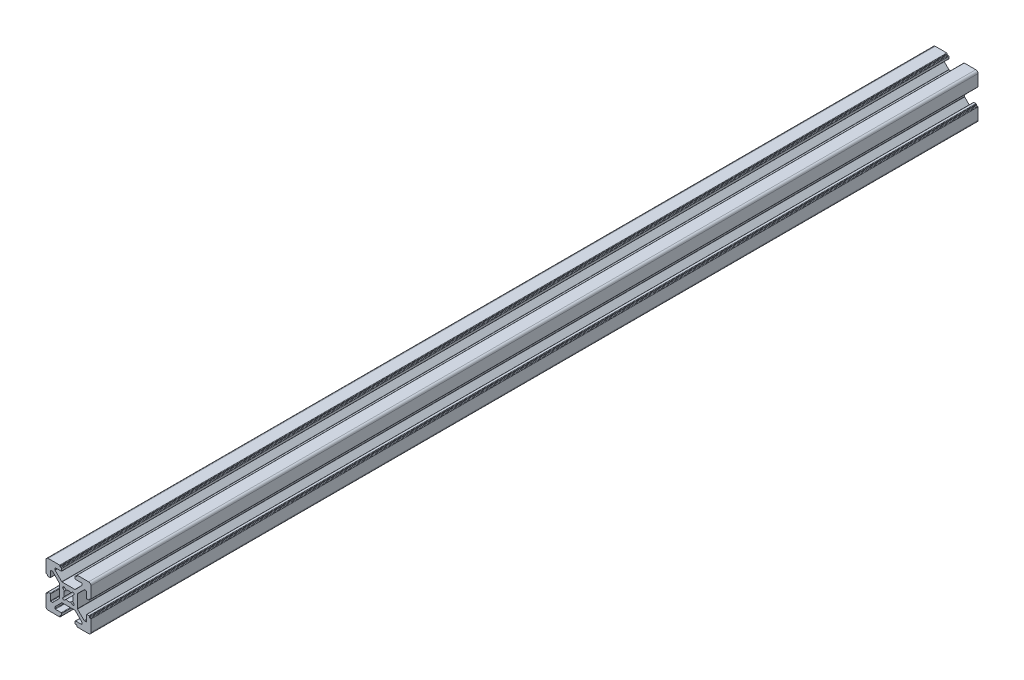
from build123d import *

# Parameters (mm, degrees)
RESSALTO_EXTRUS_O1_DEPTH = 197.5


with BuildPart() as part:
    # Model → Ressalto-extrusão1 (new, symmetric)
    with BuildSketch(Plane.XY):
        with BuildLine():
            Line((-10, 9), (-10, 3.9))
            ThreePointArc((-10, 3.9), (-9.941421356, 3.758578644), (-9.8, 3.7))
            Line((-9.8, 3.7), (-9.5, 3.7))
            ThreePointArc((-9.5, 3.7), (-9.358578644, 3.641421356), (-9.3, 3.5))
            Line((-9.3, 3.5), (-9.3, 3.2))
            ThreePointArc((-9.3, 3.2), (-9.241421356, 3.058578644), (-9.1, 3))
            Line((-9.1, 3), (-8.2, 3))
            ThreePointArc((-8.2, 3), (-8.058578644, 3.058578644), (-8, 3.2))
            Line((-8, 3.2), (-8, 5.8))
            ThreePointArc((-8, 5.8), (-7.941421356, 5.941421356), (-7.8, 6))
            Line((-7.8, 6), (-7.143502884, 6))
            ThreePointArc((-7.143502884, 6), (-7.066966198, 5.984775907), (-7.002081528, 5.941421356))
            Line((-7.002081528, 5.941421356), (-4.058578644, 2.997918472))
            ThreePointArc((-4.058578644, 2.997918472), (-4.015224093, 2.933033802), (-4, 2.856497116))
            Line((-4, 2.856497116), (-4, -2.856497116))
            ThreePointArc((-4, -2.856497116), (-4.015224093, -2.933033802), (-4.058578644, -2.997918472))
            Line((-4.058578644, -2.997918472), (-7.002081528, -5.941421356))
            ThreePointArc((-7.002081528, -5.941421356), (-7.066966198, -5.984775907), (-7.143502884, -6))
            Line((-7.143502884, -6), (-7.8, -6))
            ThreePointArc((-7.8, -6), (-7.941421356, -5.941421356), (-8, -5.8))
            Line((-8, -5.8), (-8, -3.2))
            ThreePointArc((-8, -3.2), (-8.058578644, -3.058578644), (-8.2, -3))
            Line((-8.2, -3), (-9.1, -3))
            ThreePointArc((-9.1, -3), (-9.241421356, -3.058578644), (-9.3, -3.2))
            Line((-9.3, -3.2), (-9.3, -3.5))
            ThreePointArc((-9.3, -3.5), (-9.358578644, -3.641421356), (-9.5, -3.7))
            Line((-9.5, -3.7), (-9.8, -3.7))
            ThreePointArc((-9.8, -3.7), (-9.941421356, -3.758578644), (-10, -3.9))
            Line((-10, -3.9), (-10, -9))
            ThreePointArc((-10, -9), (-9.707106781, -9.707106781), (-9, -10))
            Line((-9, -10), (-3.9, -10))
            ThreePointArc((-3.9, -10), (-3.758578644, -9.941421356), (-3.7, -9.8))
            Line((-3.7, -9.8), (-3.7, -9.5))
            ThreePointArc((-3.7, -9.5), (-3.641421356, -9.358578644), (-3.5, -9.3))
            Line((-3.5, -9.3), (-3.2, -9.3))
            ThreePointArc((-3.2, -9.3), (-3.058578644, -9.241421356), (-3, -9.1))
            Line((-3, -9.1), (-3, -8.2))
            ThreePointArc((-3, -8.2), (-3.058578644, -8.058578644), (-3.2, -8))
            Line((-3.2, -8), (-5.8, -8))
            ThreePointArc((-5.8, -8), (-5.941421356, -7.941421356), (-6, -7.8))
            Line((-6, -7.8), (-6, -7.143502884))
            ThreePointArc((-6, -7.143502884), (-5.984775907, -7.066966198), (-5.941421356, -7.002081528))
            Line((-5.941421356, -7.002081528), (-2.997918472, -4.058578644))
            ThreePointArc((-2.997918472, -4.058578644), (-2.933033802, -4.015224093), (-2.856497116, -4))
            Line((-2.856497116, -4), (2.856497116, -4))
            ThreePointArc((2.856497116, -4), (2.933033802, -4.015224093), (2.997918472, -4.058578644))
            Line((2.997918472, -4.058578644), (5.941421356, -7.002081528))
            ThreePointArc((5.941421356, -7.002081528), (5.984775907, -7.066966198), (6, -7.143502884))
            Line((6, -7.143502884), (6, -7.8))
            ThreePointArc((6, -7.8), (5.941421356, -7.941421356), (5.8, -8))
            Line((5.8, -8), (3.2, -8))
            ThreePointArc((3.2, -8), (3.058578644, -8.058578644), (3, -8.2))
            Line((3, -8.2), (3, -9.1))
            ThreePointArc((3, -9.1), (3.058578644, -9.241421356), (3.2, -9.3))
            Line((3.2, -9.3), (3.5, -9.3))
            ThreePointArc((3.5, -9.3), (3.641421356, -9.358578644), (3.7, -9.5))
            Line((3.7, -9.5), (3.7, -9.8))
            ThreePointArc((3.7, -9.8), (3.758578644, -9.941421356), (3.9, -10))
            Line((3.9, -10), (9, -10))
            ThreePointArc((9, -10), (9.707106781, -9.707106781), (10, -9))
            Line((10, -9), (10, -3.9))
            ThreePointArc((10, -3.9), (9.941421356, -3.758578644), (9.8, -3.7))
            Line((9.8, -3.7), (9.5, -3.7))
            ThreePointArc((9.5, -3.7), (9.358578644, -3.641421356), (9.3, -3.5))
            Line((9.3, -3.5), (9.3, -3.2))
            ThreePointArc((9.3, -3.2), (9.241421356, -3.058578644), (9.1, -3))
            Line((9.1, -3), (8.2, -3))
            ThreePointArc((8.2, -3), (8.058578644, -3.058578644), (8, -3.2))
            Line((8, -3.2), (8, -5.8))
            ThreePointArc((8, -5.8), (7.941421356, -5.941421356), (7.8, -6))
            Line((7.8, -6), (7.143502884, -6))
            ThreePointArc((7.143502884, -6), (7.066966198, -5.984775907), (7.002081528, -5.941421356))
            Line((7.002081528, -5.941421356), (4.058578644, -2.997918472))
            ThreePointArc((4.058578644, -2.997918472), (4.015224093, -2.933033802), (4, -2.856497116))
            Line((4, -2.856497116), (4, 2.856497116))
            ThreePointArc((4, 2.856497116), (4.015224093, 2.933033802), (4.058578644, 2.997918472))
            Line((4.058578644, 2.997918472), (7.002081528, 5.941421356))
            ThreePointArc((7.002081528, 5.941421356), (7.066966198, 5.984775907), (7.143502884, 6))
            Line((7.143502884, 6), (7.8, 6))
            ThreePointArc((7.8, 6), (7.941421356, 5.941421356), (8, 5.8))
            Line((8, 5.8), (8, 3.2))
            ThreePointArc((8, 3.2), (8.058578644, 3.058578644), (8.2, 3))
            Line((8.2, 3), (9.1, 3))
            ThreePointArc((9.1, 3), (9.241421356, 3.058578644), (9.3, 3.2))
            Line((9.3, 3.2), (9.3, 3.5))
            ThreePointArc((9.3, 3.5), (9.358578644, 3.641421356), (9.5, 3.7))
            Line((9.5, 3.7), (9.8, 3.7))
            ThreePointArc((9.8, 3.7), (9.941421356, 3.758578644), (10, 3.9))
            Line((10, 3.9), (10, 9))
            ThreePointArc((10, 9), (9.707106781, 9.707106781), (9, 10))
            Line((9, 10), (3.9, 10))
            ThreePointArc((3.9, 10), (3.758578644, 9.941421356), (3.7, 9.8))
            Line((3.7, 9.8), (3.7, 9.5))
            ThreePointArc((3.7, 9.5), (3.641421356, 9.358578644), (3.5, 9.3))
            Line((3.5, 9.3), (3.2, 9.3))
            ThreePointArc((3.2, 9.3), (3.058578644, 9.241421356), (3, 9.1))
            Line((3, 9.1), (3, 8.2))
            ThreePointArc((3, 8.2), (3.058578644, 8.058578644), (3.2, 8))
            Line((3.2, 8), (5.8, 8))
            ThreePointArc((5.8, 8), (5.941421356, 7.941421356), (6, 7.8))
            Line((6, 7.8), (6, 7.143502884))
            ThreePointArc((6, 7.143502884), (5.984775907, 7.066966198), (5.941421356, 7.002081528))
            Line((5.941421356, 7.002081528), (2.997918472, 4.058578644))
            ThreePointArc((2.997918472, 4.058578644), (2.933033802, 4.015224093), (2.856497116, 4))
            Line((2.856497116, 4), (-2.856497116, 4))
            ThreePointArc((-2.856497116, 4), (-2.933033802, 4.015224093), (-2.997918472, 4.058578644))
            Line((-2.997918472, 4.058578644), (-5.941421356, 7.002081528))
            ThreePointArc((-5.941421356, 7.002081528), (-5.984775907, 7.066966198), (-6, 7.143502884))
            Line((-6, 7.143502884), (-6, 7.8))
            ThreePointArc((-6, 7.8), (-5.941421356, 7.941421356), (-5.8, 8))
            Line((-5.8, 8), (-3.2, 8))
            ThreePointArc((-3.2, 8), (-3.058578644, 8.058578644), (-3, 8.2))
            Line((-3, 8.2), (-3, 9.1))
            ThreePointArc((-3, 9.1), (-3.058578644, 9.241421356), (-3.2, 9.3))
            Line((-3.2, 9.3), (-3.5, 9.3))
            ThreePointArc((-3.5, 9.3), (-3.641421356, 9.358578644), (-3.7, 9.5))
            Line((-3.7, 9.5), (-3.7, 9.8))
            ThreePointArc((-3.7, 9.8), (-3.758578644, 9.941421356), (-3.9, 10))
            Line((-3.9, 10), (-9, 10))
            ThreePointArc((-9, 10), (-9.707106781, 9.707106781), (-10, 9))
        make_face()
        with BuildLine():
            Line((-2.4, -1.667949192), (-1.805131169, -1.073080362))
            ThreePointArc((-1.805131169, -1.073080362), (-2.02494151, -0.556427787), (-2.1, 7.27e-07))
            ThreePointArc((-2.1, 7.27e-07), (-2.024941317, 0.556428488), (-1.805131169, 1.073080362))
            Line((-1.805131169, 1.073080362), (-2.4, 1.667949192))
            ThreePointArc((-2.4, 1.667949192), (-2.512209799, 1.835882992), (-2.551612686, 2.033974417))
            ThreePointArc((-2.551612686, 2.033974417), (-2.2320662, 2.512209799), (-1.667949192, 2.4))
            Line((-1.667949192, 2.4), (-1.073080362, 1.805131169))
            ThreePointArc((-1.073080362, 1.805131169), (0, 2.1), (1.073080362, 1.805131169))
            Line((1.073080362, 1.805131169), (1.667949192, 2.4))
            ThreePointArc((1.667949192, 2.4), (2.232066117, 2.512209833), (2.551612686, 2.033974596))
            ThreePointArc((2.551612686, 2.033974596), (2.512209833, 1.835883075), (2.4, 1.667949192))
            Line((2.4, 1.667949192), (1.805131169, 1.073080362))
            ThreePointArc((1.805131169, 1.073080362), (2.024941413, 0.556428138), (2.1, 0))
            ThreePointArc((2.1, 0), (2.024941413, -0.556428138), (1.805131169, -1.073080362))
            Line((1.805131169, -1.073080362), (2.4, -1.667949192))
            ThreePointArc((2.4, -1.667949192), (2.512209833, -1.835883075), (2.551612686, -2.033974596))
            ThreePointArc((2.551612686, -2.033974596), (2.232066117, -2.512209833), (1.667949192, -2.4))
            Line((1.667949192, -2.4), (1.073080362, -1.805131169))
            ThreePointArc((1.073080362, -1.805131169), (0, -2.1), (-1.073080362, -1.805131169))
            Line((-1.073080362, -1.805131169), (-1.667949192, -2.4))
            ThreePointArc((-1.667949192, -2.4), (-2.232066034, -2.512209867), (-2.551612686, -2.033974776))
            ThreePointArc((-2.551612686, -2.033974776), (-2.512209867, -1.835883158), (-2.4, -1.667949192))
        make_face(mode=Mode.SUBTRACT)
    extrude(amount=RESSALTO_EXTRUS_O1_DEPTH, both=True)


solid = part.part
